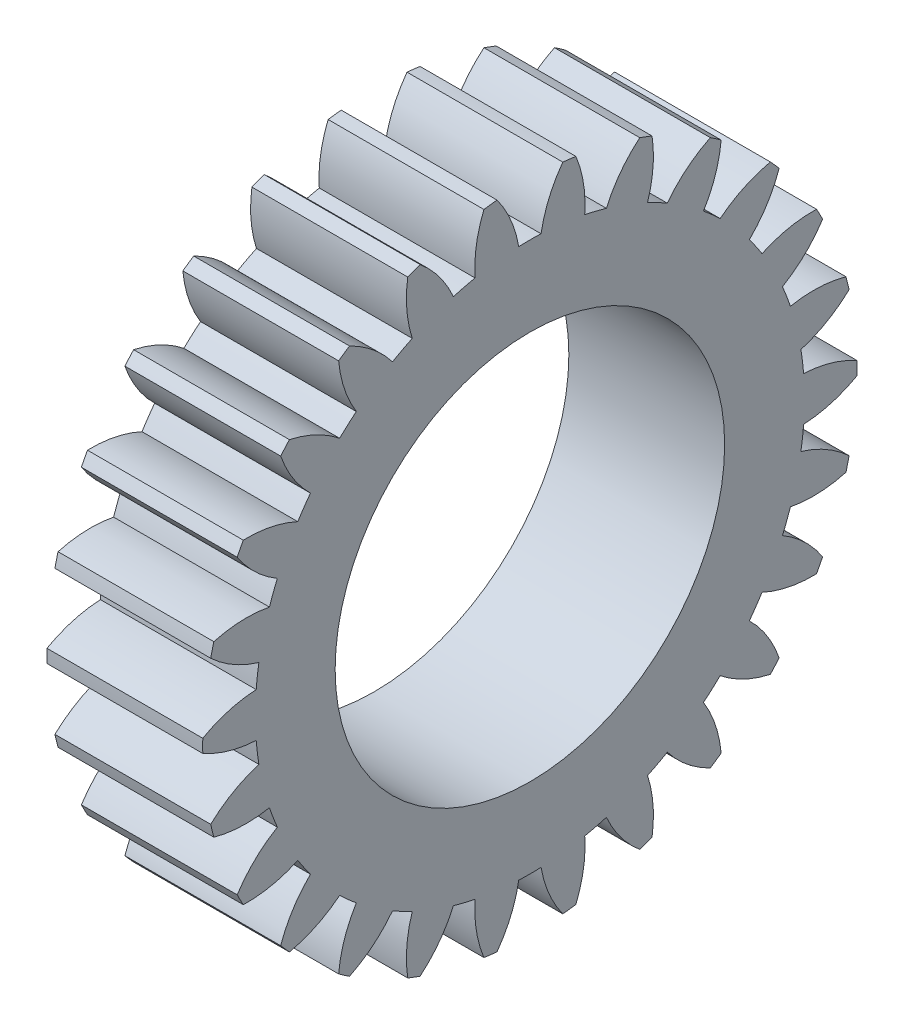
from build123d import *

# Parameters (mm, degrees)
BASPROSKE_W     = 4
BASPROSKE_H     = 8.4
TOOTHCUT_DEPTH  = 13.534751693
TEETHCUTS_COUNT = 26
TEETHCUTS_ANGLE = 346.153846154
BORSKE_R        = 5
BORE_DEPTH      = 50.0000508


with BuildPart() as part:
    # BasProSke → Base-Revolve (revolve)
    with BuildSketch(Plane(origin=(0, 0, 0), x_dir=(1, 0, 0), z_dir=(0, 1, 0)), mode=Mode.PRIVATE) as base_revolve_sk:
        with Locations((2, 4.2)):
            Rectangle(BASPROSKE_W, BASPROSKE_H)
    revolve(base_revolve_sk.sketch.rotate(Axis((-10, 0, 0), (1, 0, 0)), 180), axis=Axis((-10, 0, 0), (1, 0, 0)))

    # TooCutSke → ToothCut (cut, through all)
    with BuildSketch(Plane(origin=(0, 0, 0), x_dir=(0, 0, -1), z_dir=(1, 0, 0))):
        with BuildLine():
            ThreePointArc((0.286427071, 7.043178298), (0, 7.049), (-0.286427071, 7.043178298))
            ThreePointArc((-0.286427071, 7.043178298), (-0.494995559, 7.7462404), (-0.861910077, 8.381197777))
            ThreePointArc((-0.861910077, 8.381197777), (0, 8.4254), (0.861910077, 8.381197777))
            ThreePointArc((0.861910077, 8.381197777), (0.494995559, 7.7462404), (0.286427071, 7.043178298))
        make_face()
    toothcut = extrude(amount=TOOTHCUT_DEPTH, mode=Mode.SUBTRACT)

    # TeethCuts: ToothCut ×26 about axis
    teethcuts_axis = Axis((-10, 0, 0), (1, 0, 0))
    for i in range(1, TEETHCUTS_COUNT):
        add(toothcut.rotate(teethcuts_axis, i * TEETHCUTS_ANGLE / (TEETHCUTS_COUNT - 1)), mode=Mode.SUBTRACT)

    # BorSke → Bore (cut, symmetric)
    with BuildSketch(Plane(origin=(0, 0, 0), x_dir=(0, 0, -1), z_dir=(1, 0, 0))):
        with Locations(Location((0, 0, 0), (0, 0, 180))):
            Circle(BORSKE_R)
    extrude(amount=BORE_DEPTH, both=True, mode=Mode.SUBTRACT)


solid = part.part
